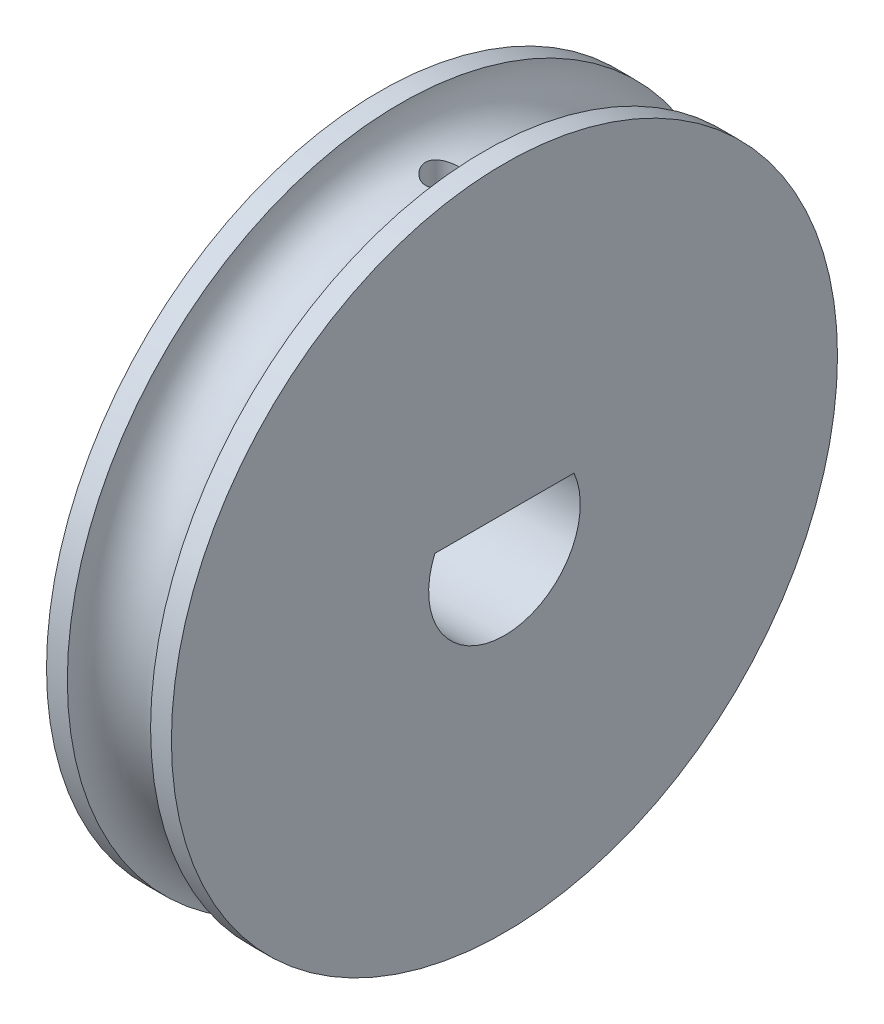
from build123d import *

# Parameters (mm, degrees)
SKETCH1_R           = 101.6
SKETCH1_R_2         = 23.124366549
BOSS_EXTRUDE1_DEPTH = 38.1
CUT_EXTRUDE1_DEPTH  = 63.5
SKETCH3_R           = 1.5
CUT_EXTRUDE4_DEPTH  = 28.902215931
SKETCH4_R           = 12.7


with BuildPart() as part:
    # Sketch1 → Boss-Extrude1 (new body)
    # profile 1 of 2: a face of its own
    with BuildSketch(Plane(origin=(0, 0, 0), x_dir=(0, 0, -1), z_dir=(1, 0, 0))):
        Circle(SKETCH1_R)
        Circle(SKETCH1_R_2, mode=Mode.SUBTRACT)
    # profile 2 of 2: a face of its own
    with BuildSketch(Plane(origin=(0, 0, 0), x_dir=(0, 0, -1), z_dir=(1, 0, 0))):
        with BuildLine():
            ThreePointArc((21.216434585, 9.197784069), (0, 23.124366549), (-21.216434585, 9.197784069))
            Line((-21.216434585, 9.197784069), (0, 9.197784069))
            Line((0, 9.197784069), (21.216434585, 9.197784069))
        make_face()
    extrude(amount=-BOSS_EXTRUDE1_DEPTH)

    # Sketch2 → Cut-Extrude1 (cut)
    with BuildSketch(Plane(origin=(0, 101.6, 0), x_dir=(1, 0, 0), z_dir=(0, 1, 0))):
        with BuildLine():
            ThreePointArc((-14.05, 0), (-15.514466094, 3.535533906), (-19.05, 5))
            Line((-19.05, 5), (-19.05, -5))
            ThreePointArc((-19.05, -5), (-15.514466094, -3.535533906), (-14.05, 0))
        make_face()
        with BuildLine():
            Line((-19.05, -5), (-19.05, 5))
            ThreePointArc((-19.05, 5), (-24.05, 0), (-19.05, -5))
        make_face()
    extrude(amount=-CUT_EXTRUDE1_DEPTH, mode=Mode.SUBTRACT)

    # Sketch3 → Cut-Extrude4 (cut)
    with BuildSketch(Plane(origin=(0, 38.1, 0), x_dir=(1, 0, 0), z_dir=(0, 1, 0))):
        with Locations(Location((-19.05, 0, 0), (0, 0, 270))):
            Circle(SKETCH3_R)
    extrude(amount=-CUT_EXTRUDE4_DEPTH, mode=Mode.SUBTRACT)

    # Sketch4 → Cut-Revolve1 (revolve, cut)
    with BuildSketch(Plane(origin=(0, 0, 0), x_dir=(1, 0, 0), z_dir=(0, 1, 0)), mode=Mode.PRIVATE) as cut_revolve1_sk:
        with Locations((-19.05, -101.6)):
            Circle(SKETCH4_R)
    revolve(cut_revolve1_sk.sketch.rotate(Axis((-18.38763681, 0, 0), (1, 0, 0)), 180), axis=Axis((-18.38763681, 0, 0), (1, 0, 0)), mode=Mode.SUBTRACT)


solid = part.part
